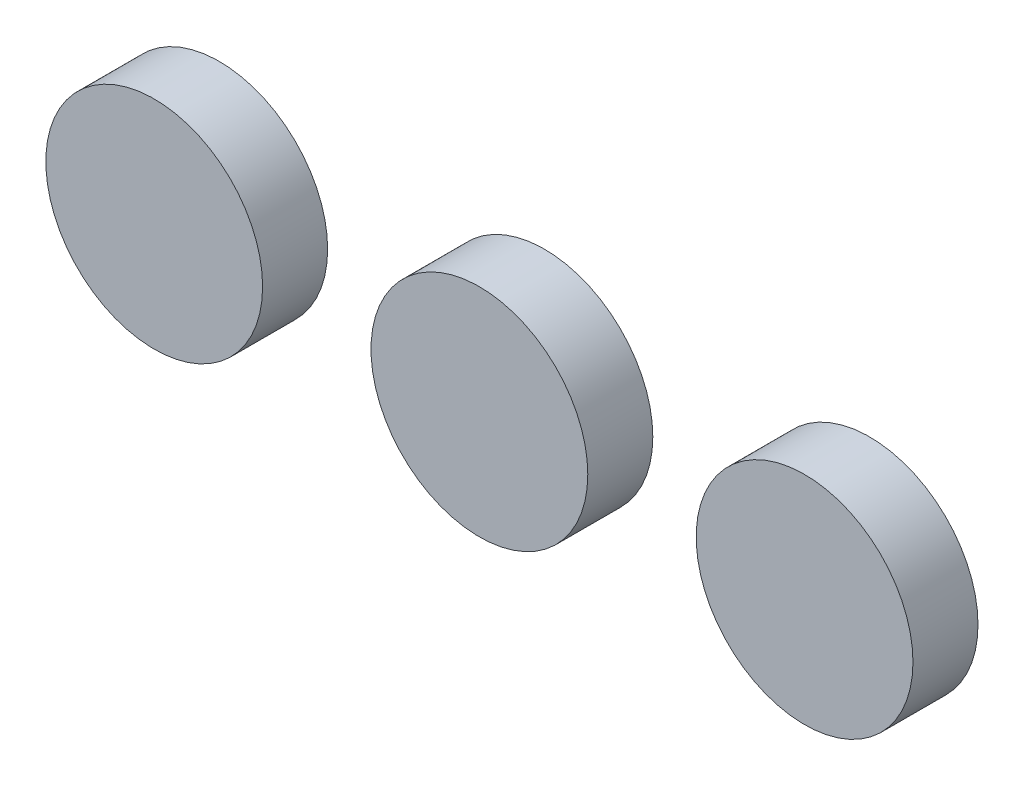
from build123d import *

# Parameters (mm, degrees)
SKETCH3_R             = 50
BOSS_EXTRUDE1_DEPTH   = 30
BOSS_EXTRUDE1_2_DEPTH = 30
BOSS_EXTRUDE1_3_DEPTH = 30


with BuildPart() as part:
    # Sketch3 → Boss-Extrude1 (new body)
    with BuildSketch(Plane.XY.offset(175)):
        with Locations((150, -100)):
            Circle(SKETCH3_R)
    extrude(amount=-BOSS_EXTRUDE1_DEPTH)


with BuildPart() as body_2:
    # Sketch3 → Boss-Extrude1 2 (new body)
    with BuildSketch(Plane.XY.offset(175)):
        with Locations((0, -100)):
            Circle(SKETCH3_R)
    extrude(amount=-BOSS_EXTRUDE1_2_DEPTH)


with BuildPart() as body_3:
    # Sketch3 → Boss-Extrude1 3 (new body)
    with BuildSketch(Plane.XY.offset(175)):
        with Locations((-150, -100)):
            Circle(SKETCH3_R)
    extrude(amount=-BOSS_EXTRUDE1_3_DEPTH)


solid = Compound([part.part, body_2.part, body_3.part])
